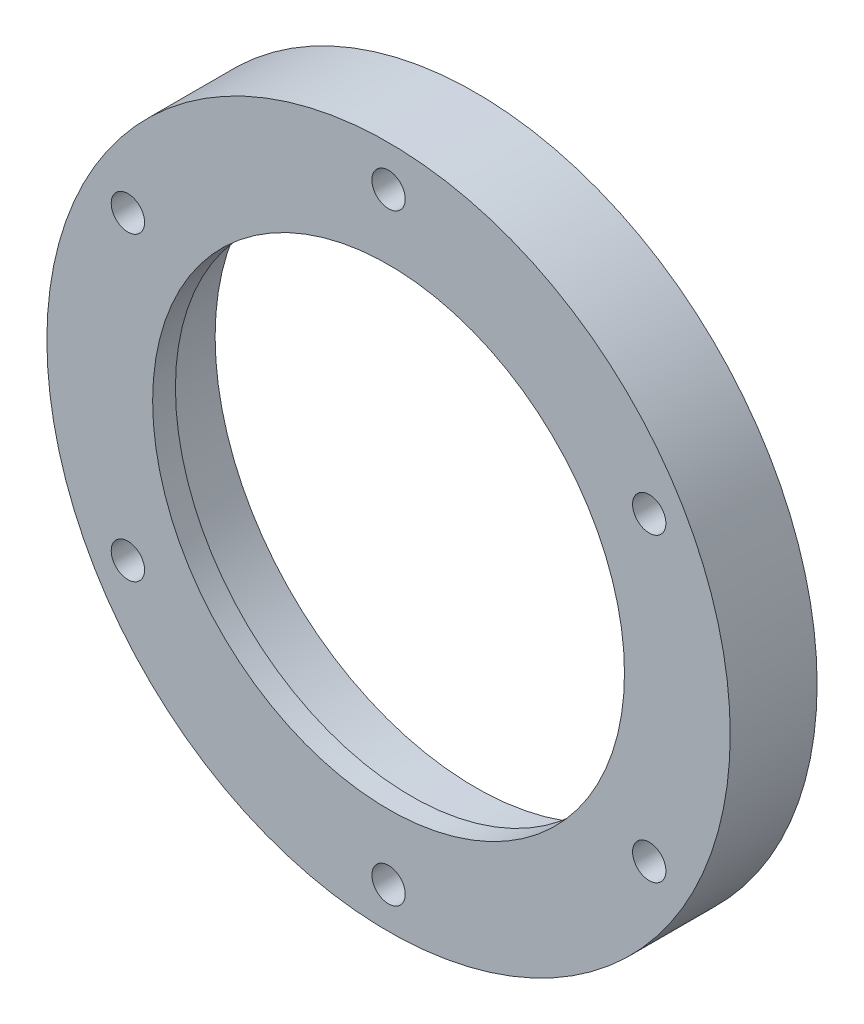
from build123d import *

# Parameters (mm, degrees)
SKETCH_1_R               = 21
SKETCH_1_R_2             = 16
EXTRUDE_1_DEPTH          = 1.97
EXTRUDE_START            = 1.4
SKETCH_2_R               = 21
SKETCH_2_R_2             = 14.5
EXTRUDE_2_DEPTH          = 1.4
HOLE_WIZARD_M2_5_1_D     = 2.05
PATTERN_CIRCULAR_1_COUNT = 6


with BuildPart() as part:
    # 草图1 → 凸台-拉伸1 (new, symmetric)
    with BuildSketch(Plane.XY):
        Circle(SKETCH_1_R)
        Circle(SKETCH_1_R_2, mode=Mode.SUBTRACT)
    extrude(amount=EXTRUDE_1_DEPTH, both=True)

    # 草图2 → 凸台-拉伸2 (add)
    with BuildSketch(Plane.XY.offset(1.97).offset(EXTRUDE_START)):
        Circle(SKETCH_2_R)
        Circle(SKETCH_2_R_2, mode=Mode.SUBTRACT)
    extrude(amount=-EXTRUDE_2_DEPTH)

    # M2.5 螺纹孔1 (through all)
    with Locations(Plane(origin=(0, 0, -1.97), x_dir=(-1, 0, 0), z_dir=(0, 0, -1))):
        with Locations((0, 18.5)):
            hole_wizard_m2_5_1 = Hole(HOLE_WIZARD_M2_5_1_D / 2)

    # 阵列(圆周)1: M2.5 螺纹孔1 ×6 about axis
    pattern_circular_1_axis = Axis((0, 0, 0), (0, 0, 1))
    for i in range(1, PATTERN_CIRCULAR_1_COUNT):
        add(hole_wizard_m2_5_1.rotate(pattern_circular_1_axis, i * 360 / PATTERN_CIRCULAR_1_COUNT), mode=Mode.SUBTRACT)


solid = part.part
